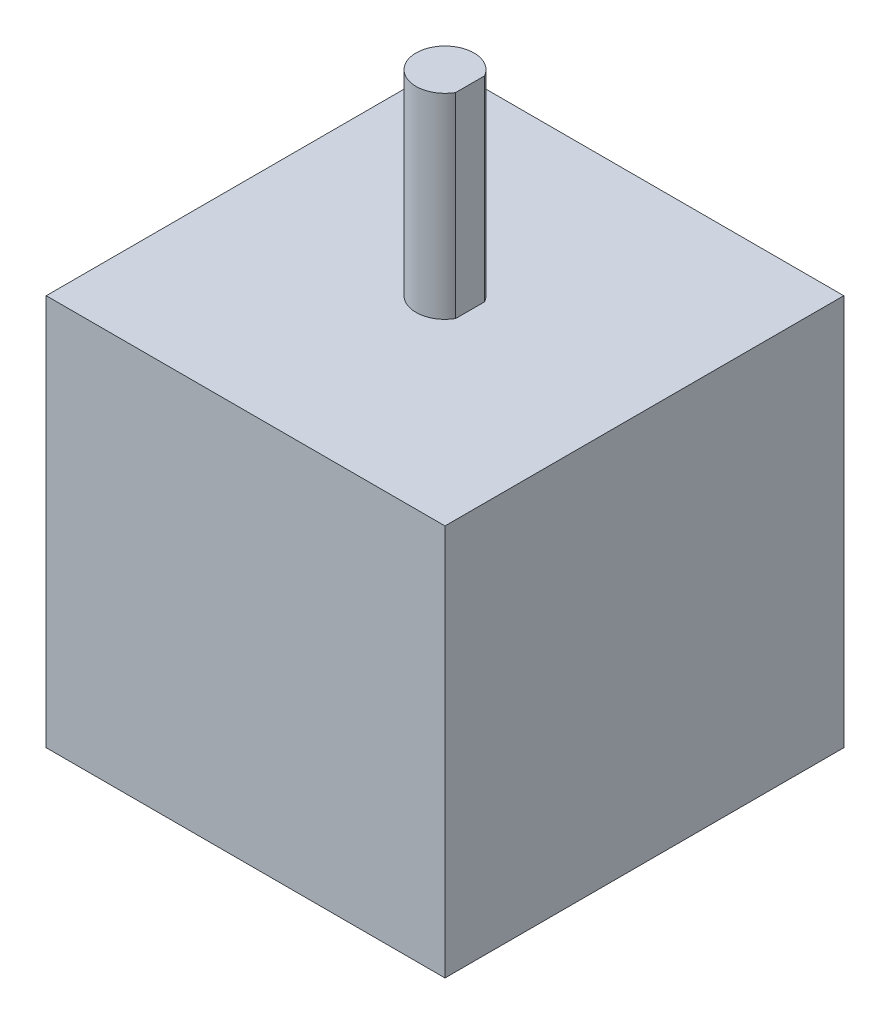
from build123d import *

# Parameters (mm, degrees)
SKETCH1_W           = 55
SKETCH1_H           = 55
BOSS_EXTRUDE1_DEPTH = 54
SKETCH2_R           = 4
BOSS_EXTRUDE2_DEPTH = 27
CUT_EXTRUDE1_DEPTH  = 27


with BuildPart() as part:
    # Sketch1 → Boss-Extrude1 (new body)
    with BuildSketch(Plane(origin=(0, 0, 0), x_dir=(1, 0, 0), z_dir=(0, 1, 0))):
        Rectangle(SKETCH1_W, SKETCH1_H)
    extrude(amount=BOSS_EXTRUDE1_DEPTH)

    # Sketch2 → Boss-Extrude2 (add)
    with BuildSketch(Plane(origin=(0, 54, 0), x_dir=(1, 0, 0), z_dir=(0, 1, 0))):
        with Locations(Location((0, 0, 0), (0, 0, 90))):
            Circle(SKETCH2_R)
    extrude(amount=BOSS_EXTRUDE2_DEPTH)

    # Sketch3 → Cut-Extrude1 (cut)
    with BuildSketch(Plane(origin=(0, 81, 0), x_dir=(1, 0, 0), z_dir=(0, 1, 0))):
        Polygon((3.464101615, 2), (3.464101615, -2), (4.924902358, -3.067380236), (7.380842693, 1.390151472), align=None)
    extrude(amount=-CUT_EXTRUDE1_DEPTH, mode=Mode.SUBTRACT)


solid = part.part
